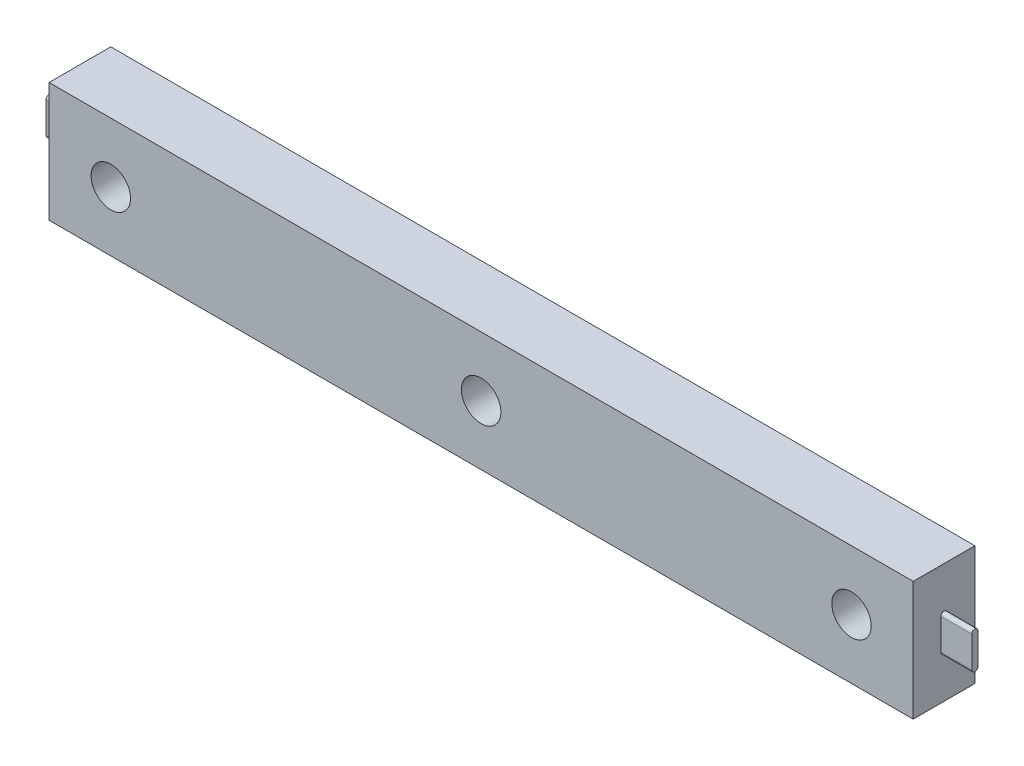
from build123d import *

# Parameters (mm, degrees)
SKETCH1_W           = 177.8
SKETCH1_H           = 24.555331286
SKETCH1_R           = 4.064
BOSS_EXTRUDE1_DEPTH = 12.7
BOSS_EXTRUDE2_DEPTH = 6.35
BOSS_EXTRUDE3_START = 6.35
BOSS_EXTRUDE3_DEPTH = 6.35


with BuildPart() as part:
    # Sketch1 → Boss-Extrude1 (new body)
    with BuildSketch(Plane.XY):
        Rectangle(SKETCH1_W, SKETCH1_H)
        Circle(SKETCH1_R, mode=Mode.SUBTRACT)
        with Locations((-76.2, 0)):
            Circle(SKETCH1_R, mode=Mode.SUBTRACT)
        with Locations((76.2, 0)):
            Circle(SKETCH1_R, mode=Mode.SUBTRACT)
    extrude(amount=BOSS_EXTRUDE1_DEPTH)

    # Sketch2 → Boss-Extrude2 (add)
    with BuildSketch(Plane.ZY.offset(88.9)):
        with BuildLine():
            Line((5.715, -3.175), (5.715, 3.175))
            ThreePointArc((5.715, 3.175), (6.35, 3.81), (6.985, 3.175))
            Line((6.985, 3.175), (6.985, -3.175))
            ThreePointArc((6.985, -3.175), (6.35, -3.81), (5.715, -3.175))
        make_face()
    extrude(amount=BOSS_EXTRUDE2_DEPTH)

    # Sketch3 → Boss-Extrude3 (add)
    with BuildSketch(Plane(origin=(88.9, 0, 0), x_dir=(0, 0, -1), z_dir=(1, 0, 0)).offset(BOSS_EXTRUDE3_START)):
        with BuildLine():
            Line((-5.715, 3.175), (-5.715, -3.175))
            ThreePointArc((-5.715, -3.175), (-6.35, -3.81), (-6.985, -3.175))
            Line((-6.985, -3.175), (-6.985, 3.175))
            ThreePointArc((-6.985, 3.175), (-6.35, 3.81), (-5.715, 3.175))
        make_face()
    extrude(amount=-BOSS_EXTRUDE3_DEPTH)


solid = part.part
